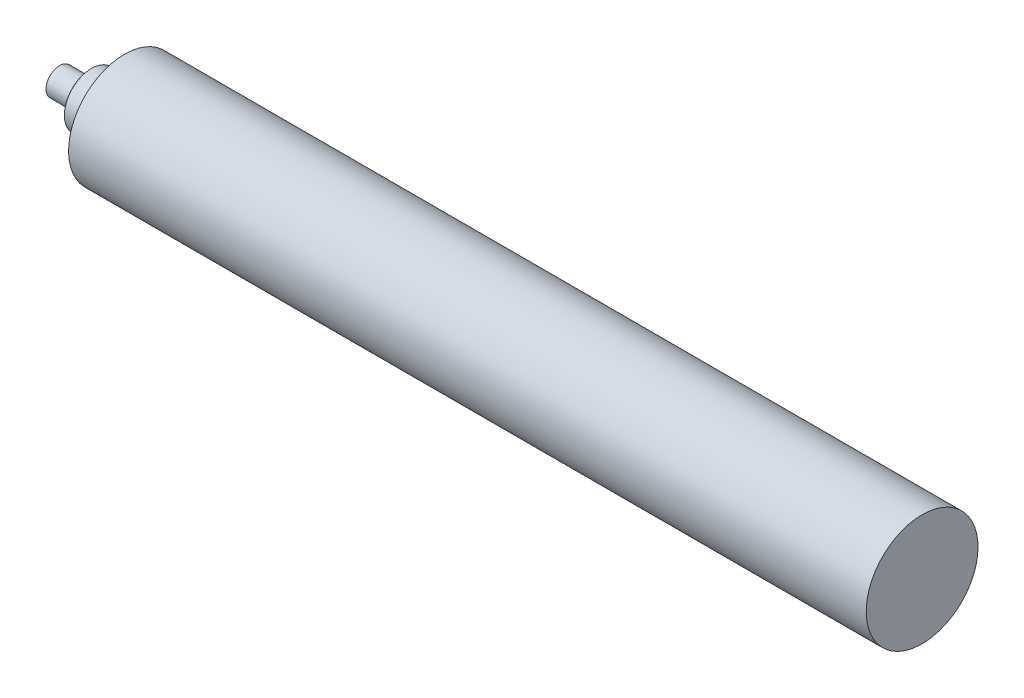
from build123d import *

# Parameters (mm, degrees)
SKETCH19_R         = 4
CUT_EXTRUDE3_DEPTH = 25.4


with BuildPart() as part:
    # Sketch1 → Revolve1 (revolve)
    with BuildSketch(Plane.XY):
        with BuildLine():
            Line((0, 0), (0, 11.938))
            Line((0, 11.938), (24.765, 11.938))
            ThreePointArc((24.765, 11.938), (26.561051224, 12.681948776), (27.305, 14.478))
            Line((27.305, 14.478), (27.305, 22.933028409))
            Line((27.305, 22.933028409), (28.104406531, 23.876))
            Line((28.104406531, 23.876), (57.15, 23.876))
            Line((57.15, 23.876), (57.15, 49.2125))
            Line((57.15, 49.2125), (759.206, 49.2125))
            Line((759.206, 49.2125), (759.206, 0))
            Line((759.206, 0), (0, 0))
        make_face()
    revolve(axis=Axis((759.206, 0, 0), (-1, 0, 0)))

    # Sketch16 → Cut-Revolve1 (revolve, cut)
    with BuildSketch(Plane(origin=(0, 0, 0), x_dir=(1, 0, 0), z_dir=(0, 1, 0))):
        Polygon((0, 0), (0, 8.35025), (1.905, 6.556375), (1.905, 0), align=None)
    revolve(axis=Axis((1.905, 0, 0), (-1, 0, 0)), mode=Mode.SUBTRACT)

    # Sketch19 → Cut-Extrude3 (cut)
    with BuildSketch(Plane.ZY.offset(-1.905)):
        Circle(SKETCH19_R)
    extrude(amount=-CUT_EXTRUDE3_DEPTH, mode=Mode.SUBTRACT)

    # Sketch32 → Cut-Revolve6 (revolve, cut)
    with BuildSketch(Plane(origin=(0, 0, 0), x_dir=(1, 0, 0), z_dir=(0, 1, 0)), mode=Mode.PRIVATE) as cut_revolve6_sk:
        Polygon((27.305, 0), (28.575, 0), (27.305, 6.351059428), align=None)
    revolve(cut_revolve6_sk.sketch.rotate(Axis((27.305, 0, 0), (1, 0, 0)), 180), axis=Axis((27.305, 0, 0), (1, 0, 0)), mode=Mode.SUBTRACT)


solid = part.part
